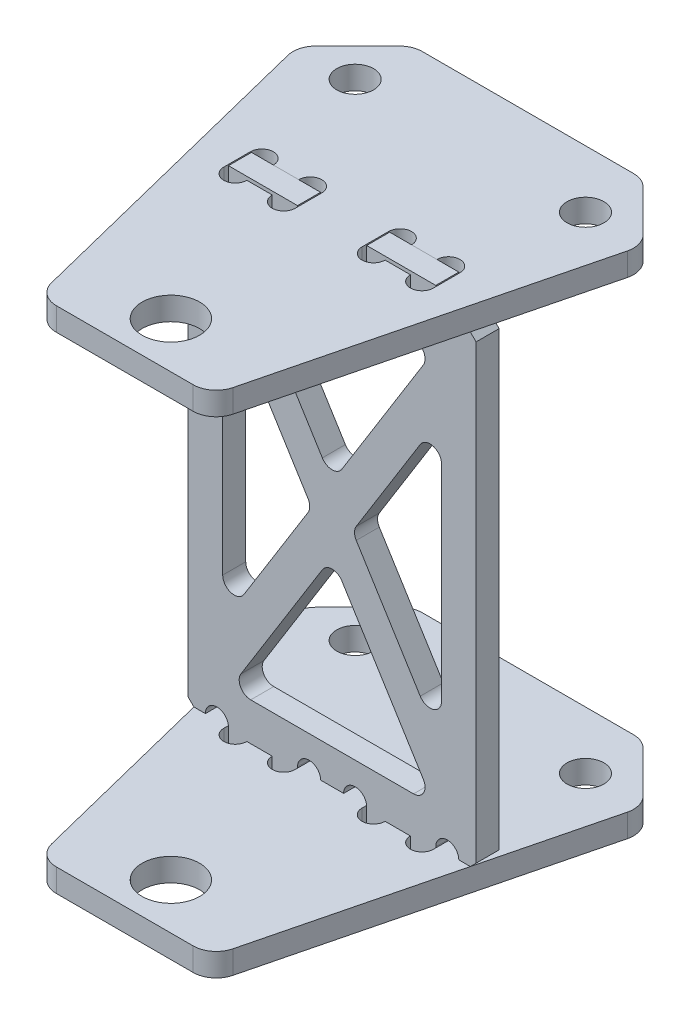
from build123d import *

# Parameters (mm, degrees)
EXTRUDE_START   = 20.1
SKETCH_1_R      = 1.6
SKETCH_1_R_2    = 2.5
EXTRUDE_1_DEPTH = 2
FILLET_1_R      = 2
EXTRUDE_2_DEPTH = 2
FILLET_2_R      = 1
CHAMFER_1_SIZE  = 0.5


with BuildPart() as part:
    # 草图1 → 凸台-拉伸1 (new body)
    with BuildSketch(Plane(origin=(0, 0, 0), x_dir=(1, 0, 0), z_dir=(0, 1, 0)).offset(EXTRUDE_START)):
        Polygon((10, 5), (-10, 5), (-15, 0), (-7.5, -30), (7.5, -30), (15, 0), align=None)
        with Locations(Location((-10, 0, 0), (0, 0, 270))):
            Circle(SKETCH_1_R, mode=Mode.SUBTRACT)
        with Locations(Location((10, 0, 0), (0, 0, 90))):
            Circle(SKETCH_1_R, mode=Mode.SUBTRACT)
        with Locations(Location((0, -26, 0), (0, 0, 270))):
            Circle(SKETCH_1_R_2, mode=Mode.SUBTRACT)
        with BuildLine():
            Line((-4.9, -10), (-7.1, -10))
            ThreePointArc((-7.1, -10), (-8.1, -9), (-9.1, -10))
            Line((-9.1, -10), (-9.1, -12.3))
            ThreePointArc((-9.1, -12.3), (-8.1, -13.3), (-7.1, -12.3))
            Line((-7.1, -12.3), (-4.9, -12.3))
            ThreePointArc((-4.9, -12.3), (-3.9, -13.3), (-2.9, -12.3))
            Line((-2.9, -12.3), (-2.9, -10))
            ThreePointArc((-2.9, -10), (-3.9, -9), (-4.9, -10))
        make_face(mode=Mode.SUBTRACT)
        with BuildLine():
            Line((4.9, -10), (7.1, -10))
            ThreePointArc((7.1, -10), (8.1, -9), (9.1, -10))
            Line((9.1, -10), (9.1, -12.3))
            ThreePointArc((9.1, -12.3), (8.1, -13.3), (7.1, -12.3))
            Line((7.1, -12.3), (4.9, -12.3))
            ThreePointArc((4.9, -12.3), (3.9, -13.3), (2.9, -12.3))
            Line((2.9, -12.3), (2.9, -10))
            ThreePointArc((2.9, -10), (3.9, -9), (4.9, -10))
        make_face(mode=Mode.SUBTRACT)
    extrude(amount=EXTRUDE_1_DEPTH)

    # 圆角1
    fillet_1_edges = [part.edges().sort_by_distance(p)[0] for p in [
        (-10, 21.1, -5),
        (10, 21.1, -5),
        (15, 21.1, 0),
        (7.5, 21.1, 30),
        (-7.5, 21.1, 30),
        (-15, 21.1, 0),
    ]]
    fillet(fillet_1_edges, radius=FILLET_1_R)


with BuildPart() as body_2:
    # 镜向2: mirrored copy
    add(part.part.mirror(Plane.ZX))


with BuildPart() as body_3:
    # 草图2 → 凸台-拉伸2 (new body)
    with BuildSketch(Plane.XY.offset(10)):
        with BuildLine():
            Line((-9, 22.1), (-3, 22.1))
            Line((-3, 22.1), (-3, 20.1))
            ThreePointArc((-3, 20.1), (-2, 19.1), (-1, 20.1))
            Line((-1, 20.1), (1, 20.1))
            ThreePointArc((1, 20.1), (2, 19.1), (3, 20.1))
            Line((3, 20.1), (3, 22.1))
            Line((3, 22.1), (9, 22.1))
            Line((9, 22.1), (9, 20.1))
            ThreePointArc((9, 20.1), (10, 19.1), (11, 20.1))
            Line((11, 20.1), (12.5, 20.1))
            Line((12.5, 20.1), (12.5, -20.1))
            Line((12.5, -20.1), (11, -20.1))
            ThreePointArc((11, -20.1), (10, -19.1), (9, -20.1))
            Line((9, -20.1), (9, -22.1))
            Line((9, -22.1), (3, -22.1))
            Line((3, -22.1), (3, -20.1))
            ThreePointArc((3, -20.1), (2, -19.1), (1, -20.1))
            Line((1, -20.1), (-1, -20.1))
            ThreePointArc((-1, -20.1), (-2, -19.1), (-3, -20.1))
            Line((-3, -20.1), (-3, -22.1))
            Line((-3, -22.1), (-9, -22.1))
            Line((-9, -22.1), (-9, -20.1))
            ThreePointArc((-9, -20.1), (-10, -19.1), (-11, -20.1))
            Line((-11, -20.1), (-12.5, -20.1))
            Line((-12.5, -20.1), (-12.5, 20.1))
            Line((-12.5, 20.1), (-11, 20.1))
            ThreePointArc((-11, 20.1), (-10, 19.1), (-9, 20.1))
            Line((-9, 20.1), (-9, 22.1))
        make_face()
        Polygon((-9.5, 12.43562256), (-1.76640388, 0), (-9.5, -12.43562256), align=None, mode=Mode.SUBTRACT)
        Polygon((8.867924478, 17.1), (0, 2.84037744), (-8.867924478, 17.1), align=None, mode=Mode.SUBTRACT)
        Polygon((9.5, 12.43562256), (1.76640388, 0), (9.5, -12.43562256), align=None, mode=Mode.SUBTRACT)
        Polygon((-8.867924478, -17.1), (8.867924478, -17.1), (0, -2.84037744), align=None, mode=Mode.SUBTRACT)
    extrude(amount=EXTRUDE_2_DEPTH)

    # 圆角2
    fillet_2_edges = [body_3.edges().sort_by_distance(p)[0] for p in [
        (-8.867924478, 17.1, 11),
        (0, 2.84037744, 11),
        (8.867924478, 17.1, 11),
        (-9.5, -12.43562256, 11),
        (-1.76640388, 0, 11),
        (-9.5, 12.43562256, 11),
        (0, -2.84037744, 11),
        (-8.867924478, -17.1, 11),
        (8.867924478, -17.1, 11),
        (1.76640388, 0, 11),
        (9.5, -12.43562256, 11),
        (9.5, 12.43562256, 11),
    ]]
    fillet(fillet_2_edges, radius=FILLET_2_R)

    # 倒角1
    chamfer_1_edges = [body_3.edges().sort_by_distance(p)[0] for p in [
        (12.5, 20.1, 11),
        (12.5, -20.1, 11),
        (-12.5, -20.1, 11),
        (-12.5, 20.1, 11),
    ]]
    chamfer(chamfer_1_edges, length=CHAMFER_1_SIZE)


solid = Compound([part.part, body_2.part, body_3.part])
